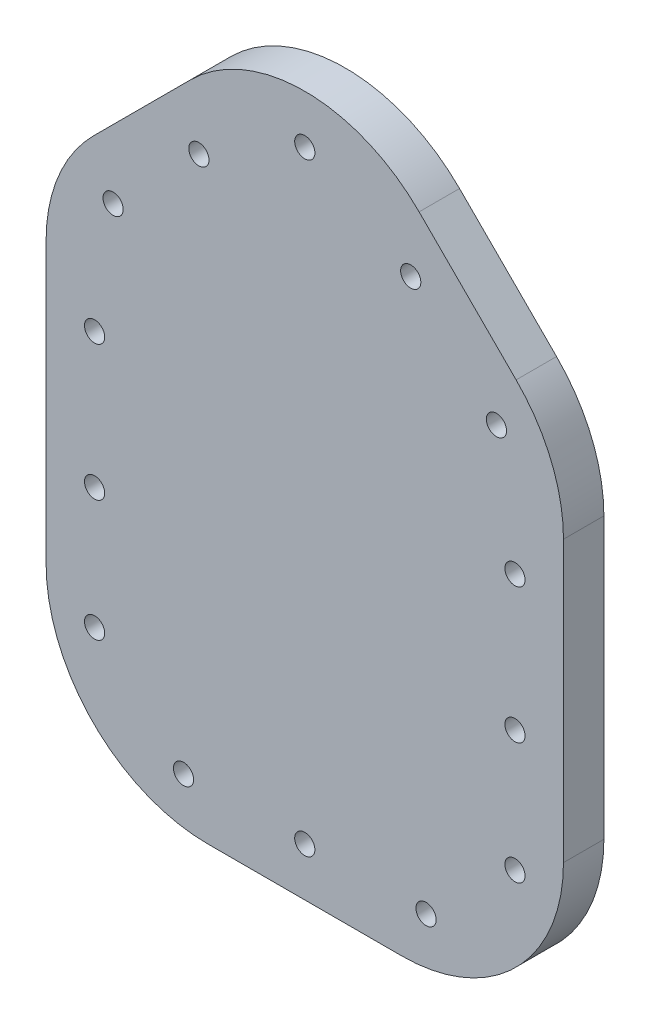
from build123d import *

# Parameters (mm, degrees)
SKETCH1_R           = 1.25
BOSS_EXTRUDE1_DEPTH = 5
FILLET1_R           = 20


with BuildPart() as part:
    # Sketch1 → Boss-Extrude1 (new body)
    with BuildSketch(Plane.XY):
        with BuildLine():
            Line((32, 5), (-32, 5))
            Line((-32, 5), (-32, 59.644660941))
            ThreePointArc((-32, 59.644660941), (-30.47759065, 67.298329588), (-26.142135624, 73.786796564))
            Line((-26.142135624, 73.786796564), (-14.142135624, 85.786796564))
            ThreePointArc((-14.142135624, 85.786796564), (0, 91.644660941), (14.142135624, 85.786796564))
            Line((14.142135624, 85.786796564), (26.142135624, 73.786796564))
            ThreePointArc((26.142135624, 73.786796564), (30.47759065, 67.298329588), (32, 59.644660941))
            Line((32, 59.644660941), (32, 5))
        make_face()
        with Locations((0, 85.644660941)):
            Circle(SKETCH1_R, mode=Mode.SUBTRACT)
        with Locations((-13.102089171, 78.341561643)):
            Circle(SKETCH1_R, mode=Mode.SUBTRACT)
        with Locations((-23.708690889, 67.734959925)):
            Circle(SKETCH1_R, mode=Mode.SUBTRACT)
        with Locations((-26, 52.910996131)):
            Circle(SKETCH1_R, mode=Mode.SUBTRACT)
        with Locations((-26, 36.198039027)):
            Circle(SKETCH1_R, mode=Mode.SUBTRACT)
        with Locations((-26, 21.198039027)):
            Circle(SKETCH1_R, mode=Mode.SUBTRACT)
        with Locations((0, 11)):
            Circle(SKETCH1_R, mode=Mode.SUBTRACT)
        with Locations((-15, 11)):
            Circle(SKETCH1_R, mode=Mode.SUBTRACT)
        with Locations(Location((13.102089171, 78.341561643, 0), (0, 0, 180))):
            Circle(SKETCH1_R, mode=Mode.SUBTRACT)
        with Locations(Location((23.708690889, 67.734959925, 0), (0, 0, 180))):
            Circle(SKETCH1_R, mode=Mode.SUBTRACT)
        with Locations(Location((26, 52.910996131, 0), (0, 0, 180))):
            Circle(SKETCH1_R, mode=Mode.SUBTRACT)
        with Locations(Location((26, 36.198039027, 0), (0, 0, 180))):
            Circle(SKETCH1_R, mode=Mode.SUBTRACT)
        with Locations(Location((26, 21.198039027, 0), (0, 0, 180))):
            Circle(SKETCH1_R, mode=Mode.SUBTRACT)
        with Locations(Location((15, 11, 0), (0, 0, 180))):
            Circle(SKETCH1_R, mode=Mode.SUBTRACT)
    extrude(amount=BOSS_EXTRUDE1_DEPTH)

    # Fillet1
    fillet1_edges = [part.edges().sort_by_distance(p)[0] for p in [
        (32, 5, 2.5),
        (-32, 5, 2.5),
    ]]
    fillet(fillet1_edges, radius=FILLET1_R)


solid = part.part
